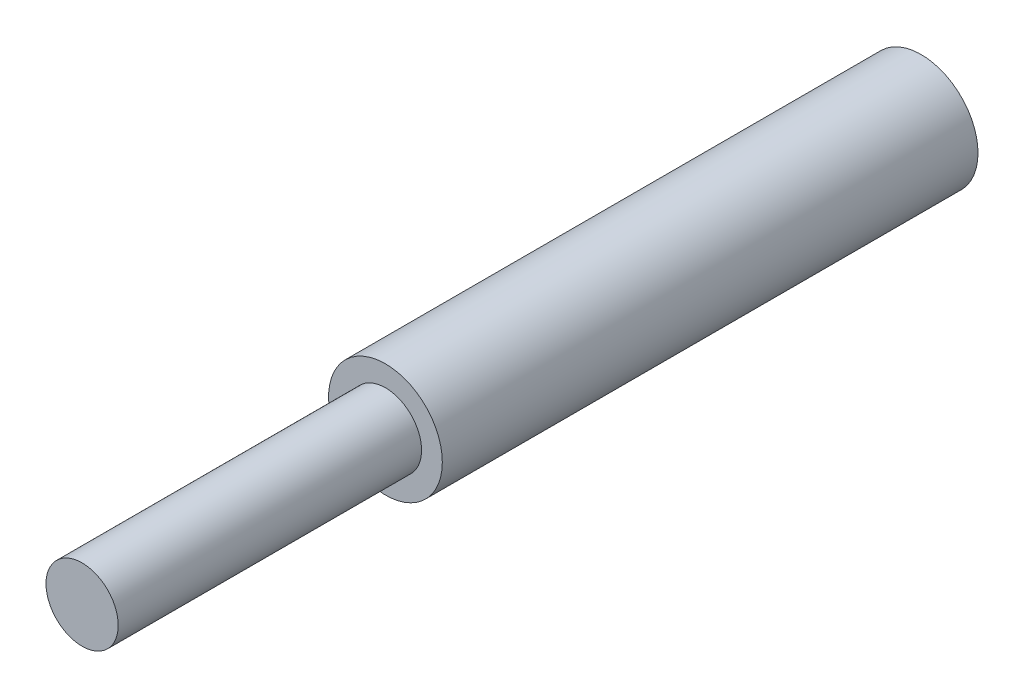
from build123d import *

# Parameters (mm, degrees)
SKETCH1_R           = 3.937
BOSS_EXTRUDE1_DEPTH = 37.084
SKETCH3_R           = 2.5
BOSS_EXTRUDE2_DEPTH = 21


with BuildPart() as part:
    # Sketch1 → Boss-Extrude1 (new body)
    with BuildSketch(Plane.XY):
        with Locations((-11.833631536, 2.73721851)):
            Circle(SKETCH1_R)
    extrude(amount=BOSS_EXTRUDE1_DEPTH)

    # Sketch3 → Boss-Extrude2 (add)
    with BuildSketch(Plane.XY.offset(37.084)):
        with Locations(Location((-11.833631536, 2.73721851, 0), (0, 0, 180))):
            Circle(SKETCH3_R)
    extrude(amount=BOSS_EXTRUDE2_DEPTH)


solid = part.part
